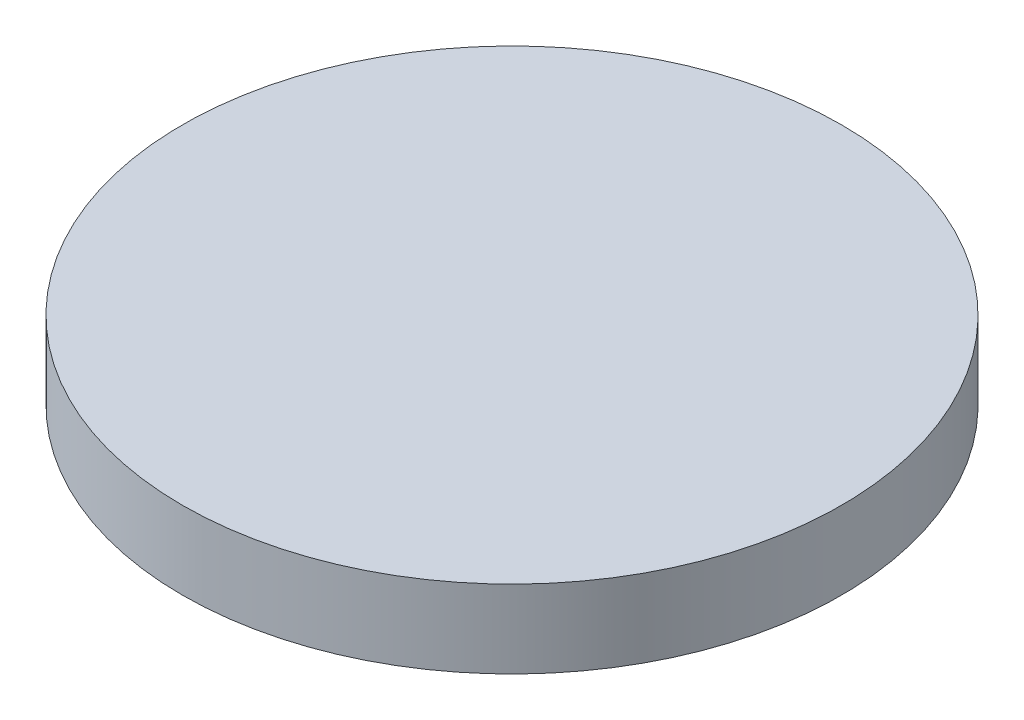
from build123d import *

# Parameters (mm, degrees)
SKETCH1_R           = 6.35
BOSS_EXTRUDE1_DEPTH = 1.5


with BuildPart() as part:
    # Sketch1 → Boss-Extrude1 (new body)
    with BuildSketch(Plane(origin=(0, 0, 0), x_dir=(1, 0, 0), z_dir=(0, 1, 0))):
        with Locations(Location((0, 0, 0), (0, 0, 270))):
            Circle(SKETCH1_R)
    extrude(amount=BOSS_EXTRUDE1_DEPTH)


solid = part.part
